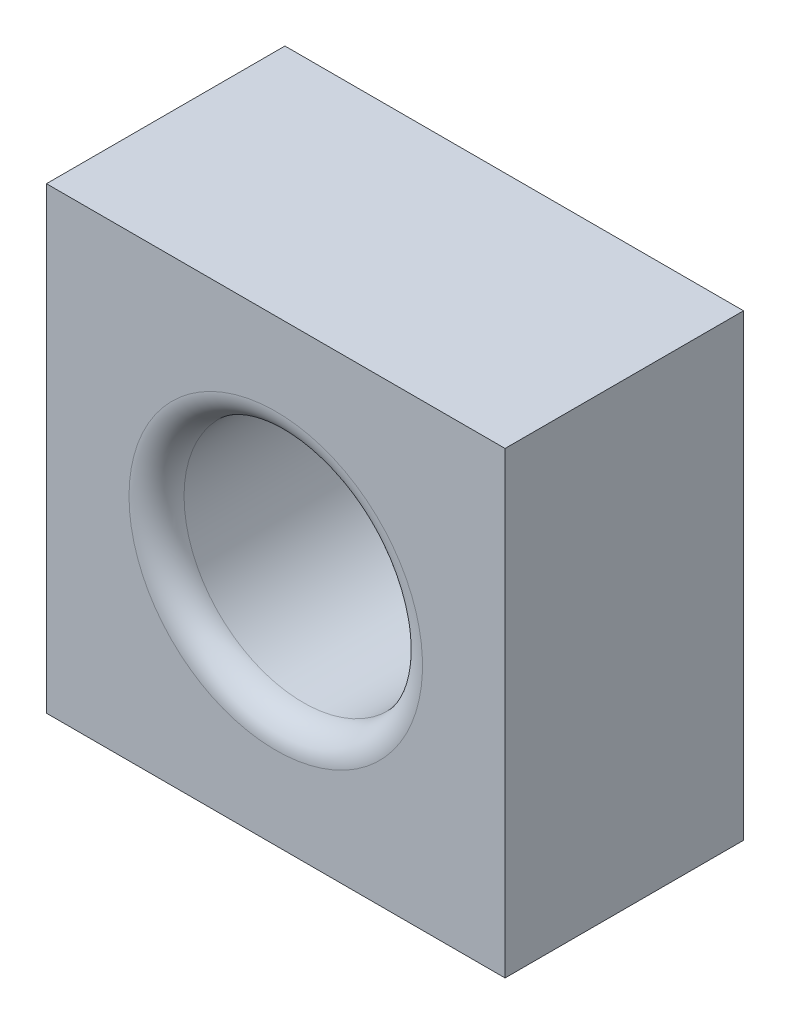
from build123d import *

# Parameters (mm, degrees)
SKETCH1_W           = 25
SKETCH1_H           = 25
SKETCH1_R           = 6.5
BOSS_EXTRUDE1_DEPTH = 13
FILLET1_R           = 1.5


with BuildPart() as part:
    # Sketch1 → Boss-Extrude1 (new body)
    with BuildSketch(Plane.XY):
        Rectangle(SKETCH1_W, SKETCH1_H)
        with Locations(Location((0, 0, 0), (0, 0, 180))):
            Circle(SKETCH1_R, mode=Mode.SUBTRACT)
    extrude(amount=BOSS_EXTRUDE1_DEPTH)

    # Fillet1
    fillet1_edges = [part.edges().sort_by_distance(p)[0] for p in [
        (6.5, 0, 13),
    ]]
    fillet(fillet1_edges, radius=FILLET1_R)


solid = part.part
